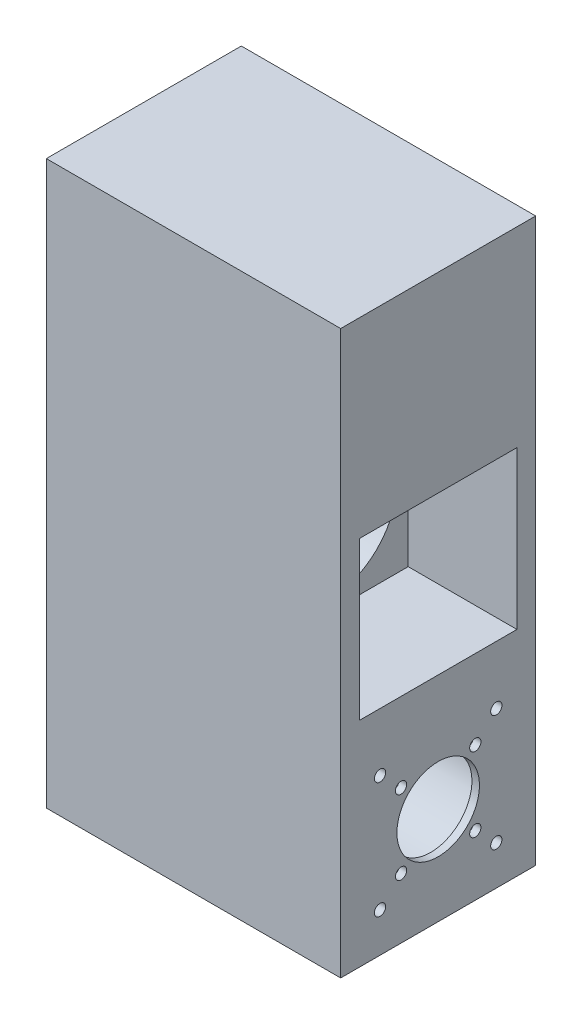
from build123d import *

# Parameters (mm, degrees)
SKETCH_1_W           = 78.5
SKETCH_1_H           = 52
EXTRUDE_1_DEPTH      = 150
SKETCH_2_W           = 42
SKETCH_2_H           = 42
CUT_EXTRUDE_1_DEPTH  = 38
SKETCH_3_R           = 18
CUT_EXTRUDE_2_DEPTH  = 38.5
CUT_EXTRUDE_3_REACH  = 172.377
SKETCH_4_R           = 11
CUT_EXTRUDE_4_REACH  = 173.284
SKETCH_5_R           = 1.5
CUT_EXTRUDE_5_REACH  = 173.284
SKETCH_8_R           = 1.5
SKETCH_15_W          = 42
SKETCH_15_H          = 88
CUT_EXTRUDE_13_DEPTH = 20
SKETCH_16_R          = 11
CUT_EXTRUDE_14_DEPTH = 2
SKETCH_17_R          = 18
CUT_EXTRUDE_15_DEPTH = 27.5
SKETCH_18_W          = 42
SKETCH_18_H          = 42
SKETCH_18_R          = 18
SKETCH_18_R_2        = 11
CUT_EXTRUDE_16_DEPTH = 29
CUT_EXTRUDE_17_REACH = 165.09
SKETCH_19_R          = 1.5


with BuildPart() as part:
    # 草图1 → 凸台-拉伸1 (new body)
    with BuildSketch(Plane(origin=(0, 0, 0), x_dir=(1, 0, 0), z_dir=(0, 1, 0))):
        Rectangle(SKETCH_1_W, SKETCH_1_H)
    extrude(amount=EXTRUDE_1_DEPTH)

    # 草图2 → 切除-拉伸1 (cut)
    with BuildSketch(Plane.ZY.offset(39.25)):
        with Locations((0, 26)):
            Rectangle(SKETCH_2_W, SKETCH_2_H)
    extrude(amount=-CUT_EXTRUDE_1_DEPTH, mode=Mode.SUBTRACT)

    # 草图3 → 切除-拉伸2 (cut)
    with BuildSketch(Plane.ZY.offset(1.25)):
        with Locations((0, 26)):
            Circle(SKETCH_3_R)
    extrude(amount=-CUT_EXTRUDE_2_DEPTH, mode=Mode.SUBTRACT)

    # 草图4 → 切除-拉伸3 (cut, up to next)
    with BuildSketch(Plane.ZY.offset(-37.25), mode=Mode.PRIVATE) as cut_extrude_3_sk1:
        with Locations((0, 26)):
            Circle(SKETCH_4_R)
    cut_extrude_3_tool1 = extrude(cut_extrude_3_sk1.sketch, amount=-CUT_EXTRUDE_3_REACH, mode=Mode.PRIVATE) & part.part
    add(cut_extrude_3_tool1.solids().sort_by_distance((37.25, 26, 0))[0], mode=Mode.SUBTRACT)

    # 草图5 → 切除-拉伸4 (cut, up to next)
    with BuildSketch(Plane(origin=(39.25, 0, 0), x_dir=(0, 0, -1), z_dir=(1, 0, 0)), mode=Mode.PRIVATE) as cut_extrude_4_sk1:
        with Locations((-9.899494937, 35.899494937)):
            Circle(SKETCH_5_R)
    cut_extrude_4_tool1 = extrude(cut_extrude_4_sk1.sketch, amount=-CUT_EXTRUDE_4_REACH, mode=Mode.PRIVATE) & part.part
    # 草图5 → 切除-拉伸4 (cut, up to next)
    with BuildSketch(Plane(origin=(39.25, 0, 0), x_dir=(0, 0, -1), z_dir=(1, 0, 0)), mode=Mode.PRIVATE) as cut_extrude_4_sk2:
        with Locations((9.899494937, 35.899494937)):
            Circle(SKETCH_5_R)
    cut_extrude_4_tool2 = extrude(cut_extrude_4_sk2.sketch, amount=-CUT_EXTRUDE_4_REACH, mode=Mode.PRIVATE) & part.part
    # 草图5 → 切除-拉伸4 (cut, up to next)
    with BuildSketch(Plane(origin=(39.25, 0, 0), x_dir=(0, 0, -1), z_dir=(1, 0, 0)), mode=Mode.PRIVATE) as cut_extrude_4_sk3:
        with Locations((9.899494937, 16.100505063)):
            Circle(SKETCH_5_R)
    cut_extrude_4_tool3 = extrude(cut_extrude_4_sk3.sketch, amount=-CUT_EXTRUDE_4_REACH, mode=Mode.PRIVATE) & part.part
    # 草图5 → 切除-拉伸4 (cut, up to next)
    with BuildSketch(Plane(origin=(39.25, 0, 0), x_dir=(0, 0, -1), z_dir=(1, 0, 0)), mode=Mode.PRIVATE) as cut_extrude_4_sk4:
        with Locations((-9.899494937, 16.100505063)):
            Circle(SKETCH_5_R)
    cut_extrude_4_tool4 = extrude(cut_extrude_4_sk4.sketch, amount=-CUT_EXTRUDE_4_REACH, mode=Mode.PRIVATE) & part.part
    add(cut_extrude_4_tool1.solids().sort_by_distance((39.25, 35.899495, 9.899495))[0], mode=Mode.SUBTRACT)
    add(cut_extrude_4_tool2.solids().sort_by_distance((39.25, 35.899495, -9.899495))[0], mode=Mode.SUBTRACT)
    add(cut_extrude_4_tool3.solids().sort_by_distance((39.25, 16.100505, -9.899495))[0], mode=Mode.SUBTRACT)
    add(cut_extrude_4_tool4.solids().sort_by_distance((39.25, 16.100505, 9.899495))[0], mode=Mode.SUBTRACT)

    # 草图8 → 切除-拉伸5 (cut, up to next)
    with BuildSketch(Plane(origin=(39.25, 0, 0), x_dir=(0, 0, -1), z_dir=(1, 0, 0)), mode=Mode.PRIVATE) as cut_extrude_5_sk1:
        with Locations((-15.5, 41.5)):
            Circle(SKETCH_8_R)
    cut_extrude_5_tool1 = extrude(cut_extrude_5_sk1.sketch, amount=-CUT_EXTRUDE_5_REACH, mode=Mode.PRIVATE) & part.part
    # 草图8 → 切除-拉伸5 (cut, up to next)
    with BuildSketch(Plane(origin=(39.25, 0, 0), x_dir=(0, 0, -1), z_dir=(1, 0, 0)), mode=Mode.PRIVATE) as cut_extrude_5_sk2:
        with Locations((15.5, 41.5)):
            Circle(SKETCH_8_R)
    cut_extrude_5_tool2 = extrude(cut_extrude_5_sk2.sketch, amount=-CUT_EXTRUDE_5_REACH, mode=Mode.PRIVATE) & part.part
    # 草图8 → 切除-拉伸5 (cut, up to next)
    with BuildSketch(Plane(origin=(39.25, 0, 0), x_dir=(0, 0, -1), z_dir=(1, 0, 0)), mode=Mode.PRIVATE) as cut_extrude_5_sk3:
        with Locations((-15.5, 10.5)):
            Circle(SKETCH_8_R)
    cut_extrude_5_tool3 = extrude(cut_extrude_5_sk3.sketch, amount=-CUT_EXTRUDE_5_REACH, mode=Mode.PRIVATE) & part.part
    # 草图8 → 切除-拉伸5 (cut, up to next)
    with BuildSketch(Plane(origin=(39.25, 0, 0), x_dir=(0, 0, -1), z_dir=(1, 0, 0)), mode=Mode.PRIVATE) as cut_extrude_5_sk4:
        with Locations((15.5, 10.5)):
            Circle(SKETCH_8_R)
    cut_extrude_5_tool4 = extrude(cut_extrude_5_sk4.sketch, amount=-CUT_EXTRUDE_5_REACH, mode=Mode.PRIVATE) & part.part
    add(cut_extrude_5_tool1.solids().sort_by_distance((39.25, 41.5, 15.5))[0], mode=Mode.SUBTRACT)
    add(cut_extrude_5_tool2.solids().sort_by_distance((39.25, 41.5, -15.5))[0], mode=Mode.SUBTRACT)
    add(cut_extrude_5_tool3.solids().sort_by_distance((39.25, 10.5, 15.5))[0], mode=Mode.SUBTRACT)
    add(cut_extrude_5_tool4.solids().sort_by_distance((39.25, 10.5, -15.5))[0], mode=Mode.SUBTRACT)

    # 草图15 → 切除-拉伸13 (cut)
    with BuildSketch(Plane.ZY.offset(39.25)):
        with Locations((0, 101)):
            Rectangle(SKETCH_15_W, SKETCH_15_H)
    extrude(amount=-CUT_EXTRUDE_13_DEPTH, mode=Mode.SUBTRACT)

    # 草图16 → 切除-拉伸14 (cut)
    with BuildSketch(Plane.ZY.offset(19.25)):
        with Locations((0, 78)):
            Circle(SKETCH_16_R)
    extrude(amount=-CUT_EXTRUDE_14_DEPTH, mode=Mode.SUBTRACT)

    # 草图17 → 切除-拉伸15 (cut)
    with BuildSketch(Plane.ZY.offset(17.25)):
        with Locations((0, 78)):
            Circle(SKETCH_17_R)
    extrude(amount=-CUT_EXTRUDE_15_DEPTH, mode=Mode.SUBTRACT)

    # 草图18 → 切除-拉伸16 (cut)
    # profile 1 of 3: a face of its own
    with BuildSketch(Plane.ZY.offset(-10.25)):
        with Locations((0, 78)):
            Rectangle(SKETCH_18_W, SKETCH_18_H)
        with Locations((0, 78)):
            Circle(SKETCH_18_R, mode=Mode.SUBTRACT)
    # profile 2 of 3: a face of its own
    with BuildSketch(Plane.ZY.offset(-10.25)):
        with Locations((0, 78)):
            Circle(SKETCH_18_R)
        with Locations((0, 78)):
            Circle(SKETCH_18_R_2, mode=Mode.SUBTRACT)
    # profile 3 of 3: a face of its own
    with BuildSketch(Plane.ZY.offset(-10.25)):
        with Locations((0, 78)):
            Circle(SKETCH_18_R_2)
    extrude(amount=-CUT_EXTRUDE_16_DEPTH, mode=Mode.SUBTRACT)

    # 草图19 → 切除-拉伸17 (cut, up to next)
    with BuildSketch(Plane.ZY.offset(19.25), mode=Mode.PRIVATE) as cut_extrude_17_sk1:
        with Locations((-9.899494937, 87.899494937)):
            Circle(SKETCH_19_R)
    cut_extrude_17_tool1 = extrude(cut_extrude_17_sk1.sketch, amount=-CUT_EXTRUDE_17_REACH, mode=Mode.PRIVATE) & part.part
    # 草图19 → 切除-拉伸17 (cut, up to next)
    with BuildSketch(Plane.ZY.offset(19.25), mode=Mode.PRIVATE) as cut_extrude_17_sk2:
        with Locations((9.899494937, 87.899494937)):
            Circle(SKETCH_19_R)
    cut_extrude_17_tool2 = extrude(cut_extrude_17_sk2.sketch, amount=-CUT_EXTRUDE_17_REACH, mode=Mode.PRIVATE) & part.part
    # 草图19 → 切除-拉伸17 (cut, up to next)
    with BuildSketch(Plane.ZY.offset(19.25), mode=Mode.PRIVATE) as cut_extrude_17_sk3:
        with Locations((9.899494937, 68.100505063)):
            Circle(SKETCH_19_R)
    cut_extrude_17_tool3 = extrude(cut_extrude_17_sk3.sketch, amount=-CUT_EXTRUDE_17_REACH, mode=Mode.PRIVATE) & part.part
    # 草图19 → 切除-拉伸17 (cut, up to next)
    with BuildSketch(Plane.ZY.offset(19.25), mode=Mode.PRIVATE) as cut_extrude_17_sk4:
        with Locations((-9.899494937, 68.100505063)):
            Circle(SKETCH_19_R)
    cut_extrude_17_tool4 = extrude(cut_extrude_17_sk4.sketch, amount=-CUT_EXTRUDE_17_REACH, mode=Mode.PRIVATE) & part.part
    add(cut_extrude_17_tool1.solids().sort_by_distance((-19.25, 87.899495, -9.899495))[0], mode=Mode.SUBTRACT)
    add(cut_extrude_17_tool2.solids().sort_by_distance((-19.25, 87.899495, 9.899495))[0], mode=Mode.SUBTRACT)
    add(cut_extrude_17_tool3.solids().sort_by_distance((-19.25, 68.100505, 9.899495))[0], mode=Mode.SUBTRACT)
    add(cut_extrude_17_tool4.solids().sort_by_distance((-19.25, 68.100505, -9.899495))[0], mode=Mode.SUBTRACT)


solid = part.part
